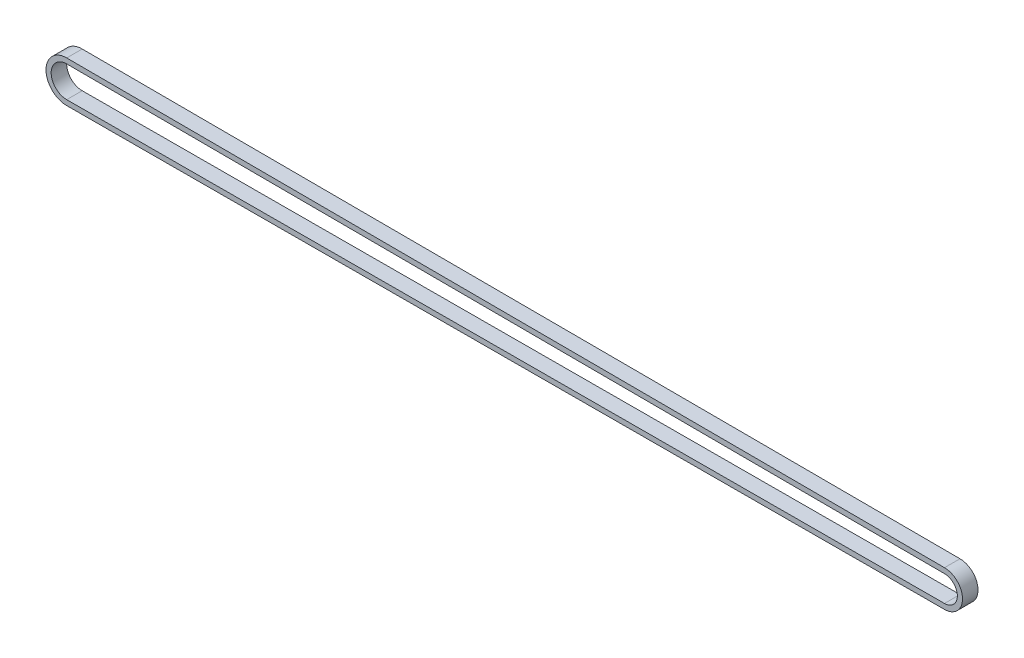
from build123d import *

# Parameters (mm, degrees)
RESSALTO_EXTRUS_O1_DEPTH = 6


with BuildPart() as part:
    # Esboço1 → Ressalto-extrusão1 (new body)
    with BuildSketch(Plane.XY):
        with BuildLine():
            Line((-339.976470588, 7.999965398), (0.020588235, 6.999969723))
            ThreePointArc((0.020588235, 6.999969723), (7, 0), (0.020588235, -6.999969723))
            Line((0.020588235, -6.999969723), (-339.976470588, -7.999965398))
            ThreePointArc((-339.976470588, -7.999965398), (-348, 0), (-339.976470588, 7.999965398))
        make_face()
        with BuildLine():
            Line((-339.982352941, 5.999974048), (0.014705882, 4.999978374))
            ThreePointArc((0.014705882, 4.999978374), (5, 0), (0.014705882, -4.999978374))
            Line((0.014705882, -4.999978374), (-339.982352941, -5.999974048))
            ThreePointArc((-339.982352941, -5.999974048), (-346, 0), (-339.982352941, 5.999974048))
        make_face(mode=Mode.SUBTRACT)
    extrude(amount=RESSALTO_EXTRUS_O1_DEPTH)


solid = part.part
